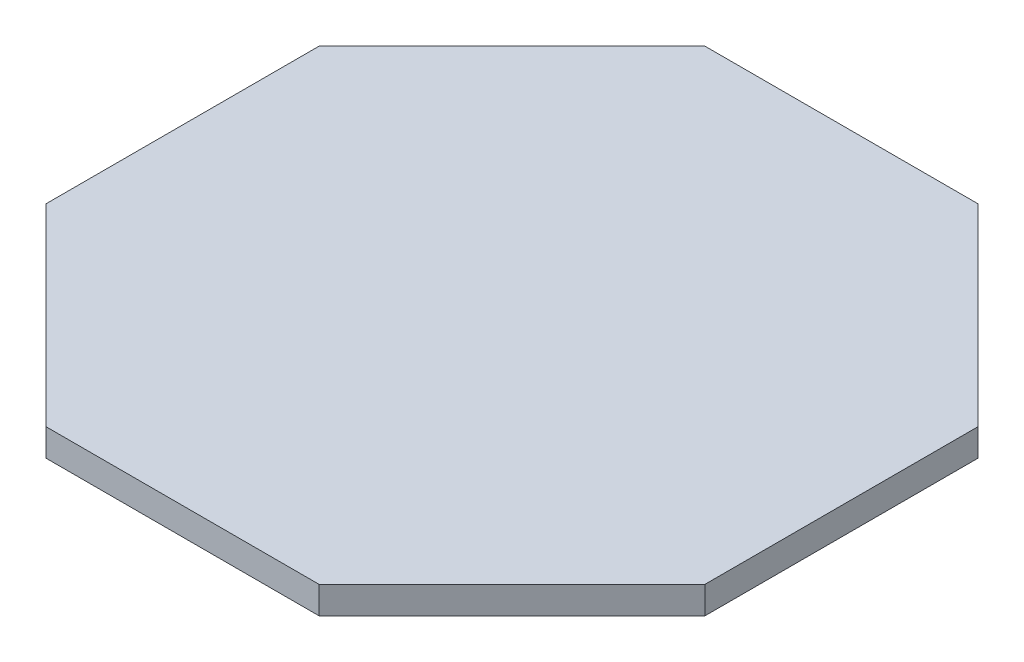
from build123d import *

# Parameters (mm, degrees)
BOSS_EXTRUDE1_DEPTH = 2


with BuildPart() as part:
    # Sketch1 → Boss-Extrude1 (new body)
    with BuildSketch(Plane(origin=(0, 0, 0), x_dir=(1, 0, 0), z_dir=(0, 1, 0))):
        Polygon((24.142135624, 10), (10, 24.142135624), (-10, 24.142135624), (-24.142135624, 10), (-24.142135624, -10), (-10, -24.142135624), (10, -24.142135624), (24.142135624, -10), align=None)
    extrude(amount=BOSS_EXTRUDE1_DEPTH)


solid = part.part
